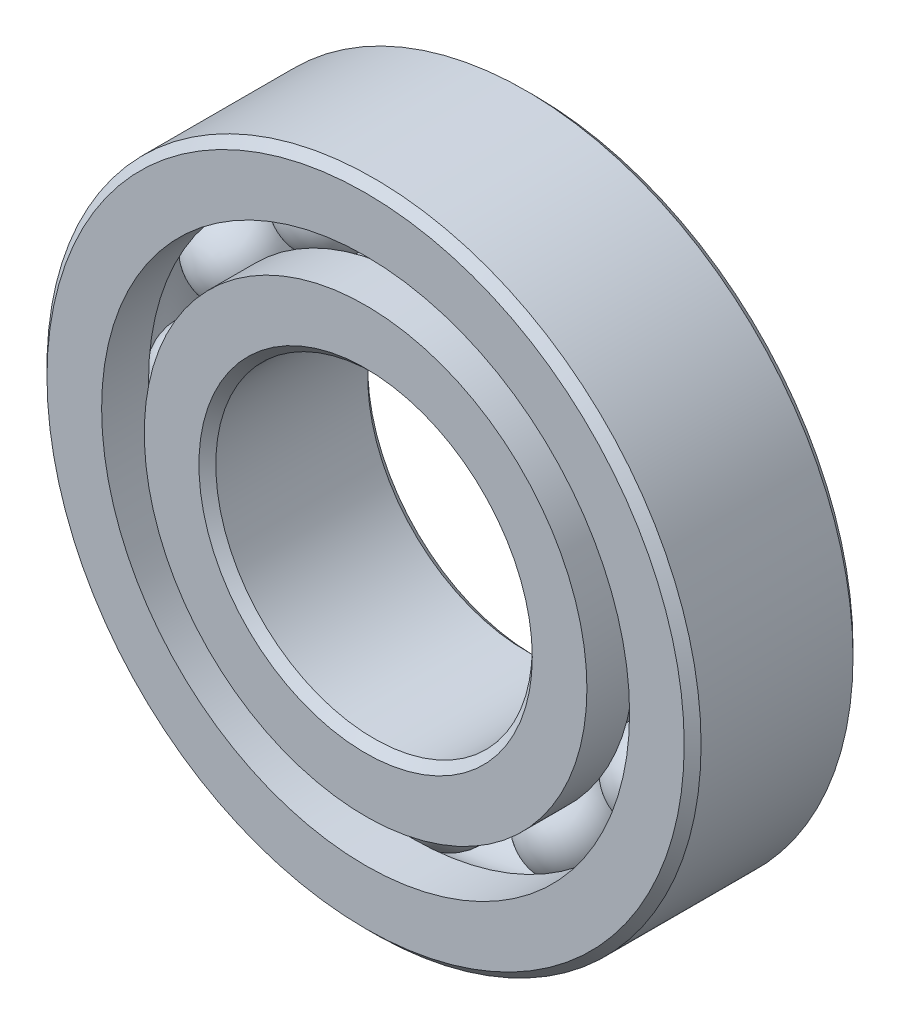
from build123d import *

# Parameters (mm, degrees)
CIRPATTERN1_COUNT = 12


with BuildPart() as part:
    # Sketch1 → Revolve1 (revolve)
    with BuildSketch(Plane(origin=(0, 0, 0), x_dir=(0, 0, -1), z_dir=(1, 0, 0))):
        with BuildLine():
            Line((7.2, 31), (-7.2, 31))
            Line((-7.2, 31), (-8, 30.2))
            Line((-8, 30.2), (-8, 25.021978022))
            Line((-8, 25.021978022), (-3.555555556, 25.021978022))
            ThreePointArc((-3.555555556, 25.021978022), (0, 27.090277549), (3.555555556, 25.021978022))
            Line((3.555555556, 25.021978022), (8, 25.021978022))
            Line((8, 25.021978022), (8, 30.2))
            Line((8, 30.2), (7.2, 31))
        make_face()
    revolve(axis=Axis((0, 0, 8), (0, 0, -1)))


with BuildPart() as body_2:
    # Sketch3 → Revolve3 (revolve)
    with BuildSketch(Plane(origin=(0, 0, 0), x_dir=(0, 0, -1), z_dir=(1, 0, 0))):
        with BuildLine():
            Line((-8, 20.978021978), (-3.555555556, 20.978021978))
            ThreePointArc((-3.555555556, 20.978021978), (0, 18.909722451), (3.555555556, 20.978021978))
            Line((3.555555556, 20.978021978), (8, 20.978021978))
            Line((8, 20.978021978), (8, 15.8))
            Line((8, 15.8), (7.2, 15))
            Line((7.2, 15), (-7.2, 15))
            Line((-7.2, 15), (-8, 15.8))
            Line((-8, 15.8), (-8, 20.978021978))
        make_face()
    revolve(axis=Axis((0, 0, 8), (0, 0, -1)))


with BuildPart() as body_3:
    # Sketch4 → Revolve4 (revolve)
    with BuildSketch(Plane(origin=(0, 0, 0), x_dir=(0, 0, -1), z_dir=(1, 0, 0))):
        with BuildLine():
            Line((-4.090277549, 23), (4.090277549, 23))
            ThreePointArc((4.090277549, 23), (0, 27.090277549), (-4.090277549, 23))
        make_face()
    revolve(axis=Axis((0, 23, 4.090277549), (0, 0, -1)))


with BuildPart() as cirpattern1_1:
    # CirPattern1: pattern copy
    add(body_3.part.rotate(Axis((0, 0, -8), (0, 0, 1)), 1 * 360 / CIRPATTERN1_COUNT))


with BuildPart() as cirpattern1_2:
    # CirPattern1: pattern copy
    add(body_3.part.rotate(Axis((0, 0, -8), (0, 0, 1)), 2 * 360 / CIRPATTERN1_COUNT))


with BuildPart() as cirpattern1_3:
    # CirPattern1: pattern copy
    add(body_3.part.rotate(Axis((0, 0, -8), (0, 0, 1)), 3 * 360 / CIRPATTERN1_COUNT))


with BuildPart() as cirpattern1_4:
    # CirPattern1: pattern copy
    add(body_3.part.rotate(Axis((0, 0, -8), (0, 0, 1)), 4 * 360 / CIRPATTERN1_COUNT))


with BuildPart() as cirpattern1_5:
    # CirPattern1: pattern copy
    add(body_3.part.rotate(Axis((0, 0, -8), (0, 0, 1)), 5 * 360 / CIRPATTERN1_COUNT))


with BuildPart() as cirpattern1_6:
    # CirPattern1: pattern copy
    add(body_3.part.rotate(Axis((0, 0, -8), (0, 0, 1)), 6 * 360 / CIRPATTERN1_COUNT))


with BuildPart() as cirpattern1_7:
    # CirPattern1: pattern copy
    add(body_3.part.rotate(Axis((0, 0, -8), (0, 0, 1)), 7 * 360 / CIRPATTERN1_COUNT))


with BuildPart() as cirpattern1_8:
    # CirPattern1: pattern copy
    add(body_3.part.rotate(Axis((0, 0, -8), (0, 0, 1)), 8 * 360 / CIRPATTERN1_COUNT))


with BuildPart() as cirpattern1_9:
    # CirPattern1: pattern copy
    add(body_3.part.rotate(Axis((0, 0, -8), (0, 0, 1)), 9 * 360 / CIRPATTERN1_COUNT))


with BuildPart() as cirpattern1_10:
    # CirPattern1: pattern copy
    add(body_3.part.rotate(Axis((0, 0, -8), (0, 0, 1)), 10 * 360 / CIRPATTERN1_COUNT))


with BuildPart() as cirpattern1_11:
    # CirPattern1: pattern copy
    add(body_3.part.rotate(Axis((0, 0, -8), (0, 0, 1)), 11 * 360 / CIRPATTERN1_COUNT))


solid = Compound([part.part, body_2.part, body_3.part, cirpattern1_1.part, cirpattern1_2.part, cirpattern1_3.part, cirpattern1_4.part, cirpattern1_5.part, cirpattern1_6.part, cirpattern1_7.part, cirpattern1_8.part, cirpattern1_9.part, cirpattern1_10.part, cirpattern1_11.part])
